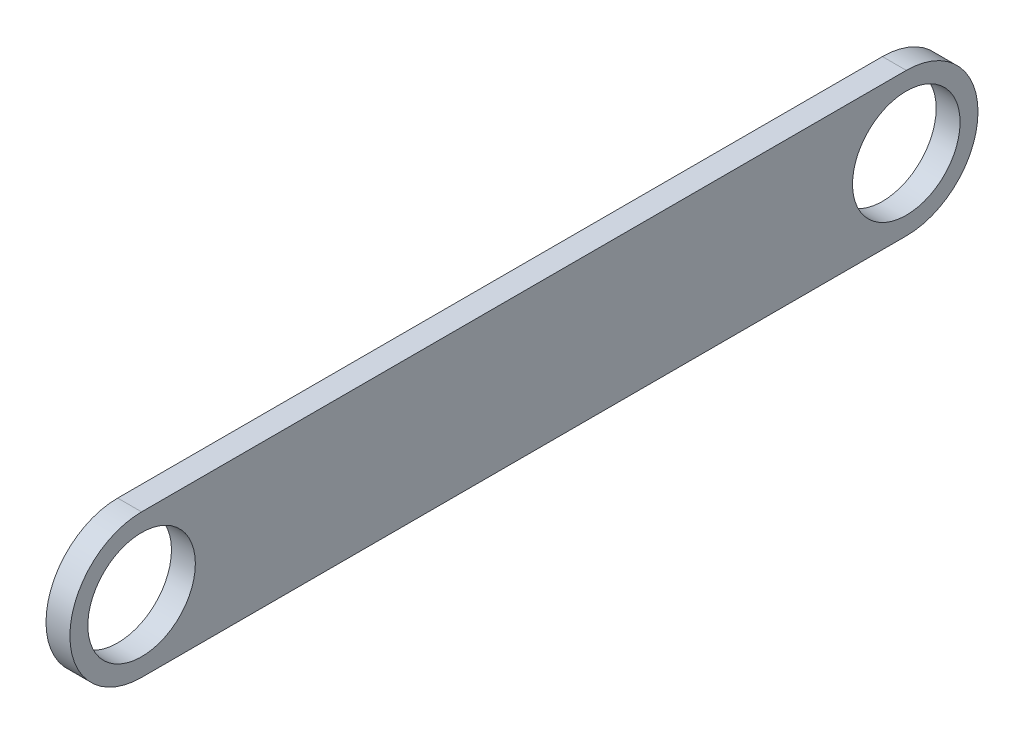
from build123d import *

# Parameters (mm, degrees)
SKETCH1_R           = 14.2875
BOSS_EXTRUDE1_DEPTH = 6.35


with BuildPart() as part:
    # Sketch1 → Boss-Extrude1 (new body)
    with BuildSketch(Plane(origin=(0, 0, 0), x_dir=(0, 0, -1), z_dir=(1, 0, 0))):
        with BuildLine():
            Line((0, 19.05), (203.2, 19.05))
            ThreePointArc((203.2, 19.05), (222.25, 0), (203.2, -19.05))
            Line((203.2, -19.05), (0, -19.05))
            ThreePointArc((0, -19.05), (-19.05, 0), (0, 19.05))
        make_face()
        Circle(SKETCH1_R, mode=Mode.SUBTRACT)
        with Locations((203.2, 0)):
            Circle(SKETCH1_R, mode=Mode.SUBTRACT)
    extrude(amount=BOSS_EXTRUDE1_DEPTH)


solid = part.part
